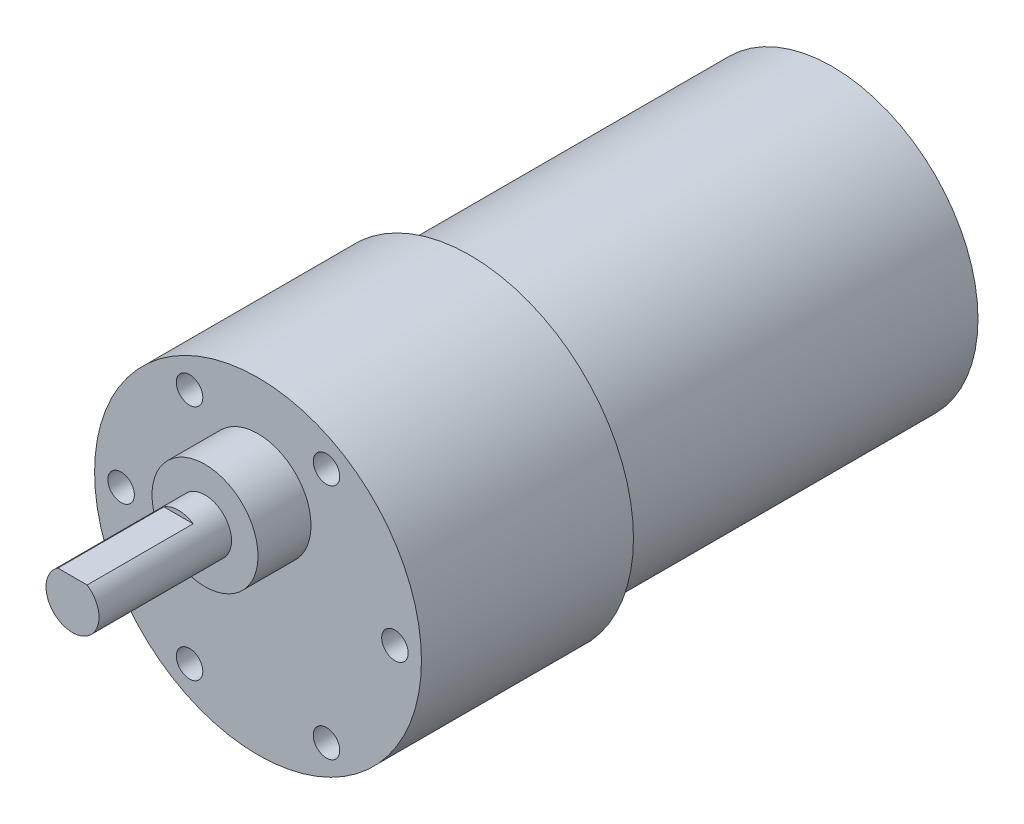
from build123d import *

# Parameters (mm, degrees)
SKETCH1_R           = 16.5
BOSS_EXTRUDE1_DEPTH = 29
SKETCH2_R           = 18.5
BOSS_EXTRUDE2_DEPTH = 24
SKETCH3_R           = 6
BOSS_EXTRUDE3_DEPTH = 6
SKETCH4_R           = 3
BOSS_EXTRUDE5_DEPTH = 3
BOSS_EXTRUDE6_DEPTH = 12
BOSS_EXTRUDE8_START = 12
SKETCH6_R           = 16.5
BOSS_EXTRUDE8_DEPTH = 12
SKETCH7_R           = 1.5
CUT_EXTRUDE1_DEPTH  = 5


with BuildPart() as part:
    # Sketch1 → Boss-Extrude1 (new body)
    with BuildSketch(Plane.XY):
        with Locations(Location((0, 0, 0), (0, 0, 180))):
            Circle(SKETCH1_R)
    extrude(amount=BOSS_EXTRUDE1_DEPTH)

    # Sketch2 → Boss-Extrude2 (add)
    with BuildSketch(Plane.XY.offset(29)):
        Circle(SKETCH2_R)
    extrude(amount=BOSS_EXTRUDE2_DEPTH)

    # Sketch3 → Boss-Extrude3 (add)
    with BuildSketch(Plane.XY.offset(53)):
        with Locations((0, 7)):
            Circle(SKETCH3_R)
    extrude(amount=BOSS_EXTRUDE3_DEPTH)

    # Sketch4 → Boss-Extrude5 (add)
    with BuildSketch(Plane.XY.offset(59)):
        with Locations((0, 7)):
            Circle(SKETCH4_R)
    extrude(amount=BOSS_EXTRUDE5_DEPTH)

    # Sketch5 → Boss-Extrude6 (add)
    with BuildSketch(Plane.XY.offset(62)):
        with BuildLine():
            Line((-1.658312395, 9.5), (1.658312395, 9.5))
            ThreePointArc((1.658312395, 9.5), (0, 4), (-1.658312395, 9.5))
        make_face()
    extrude(amount=BOSS_EXTRUDE6_DEPTH)

    # Sketch6 → Boss-Extrude8 (add)
    with BuildSketch(Plane(origin=(0, 0, 0), x_dir=(-1, 0, 0), z_dir=(0, 0, -1)).offset(BOSS_EXTRUDE8_START)):
        Circle(SKETCH6_R)
    extrude(amount=-BOSS_EXTRUDE8_DEPTH)

    # Sketch7 → Cut-Extrude1 (cut)
    with BuildSketch(Plane.XY.offset(53)):
        with Locations((-15.5, 0)):
            Circle(SKETCH7_R)
        with Locations((7.75, 13.423393759)):
            Circle(SKETCH7_R)
        with Locations((7.75, -13.423393759)):
            Circle(SKETCH7_R)
        with Locations((15.5, 0)):
            Circle(SKETCH7_R)
        with Locations((-7.75, -13.423393759)):
            Circle(SKETCH7_R)
        with Locations((-7.75, 13.423393759)):
            Circle(SKETCH7_R)
    extrude(amount=-CUT_EXTRUDE1_DEPTH, mode=Mode.SUBTRACT)


solid = part.part
